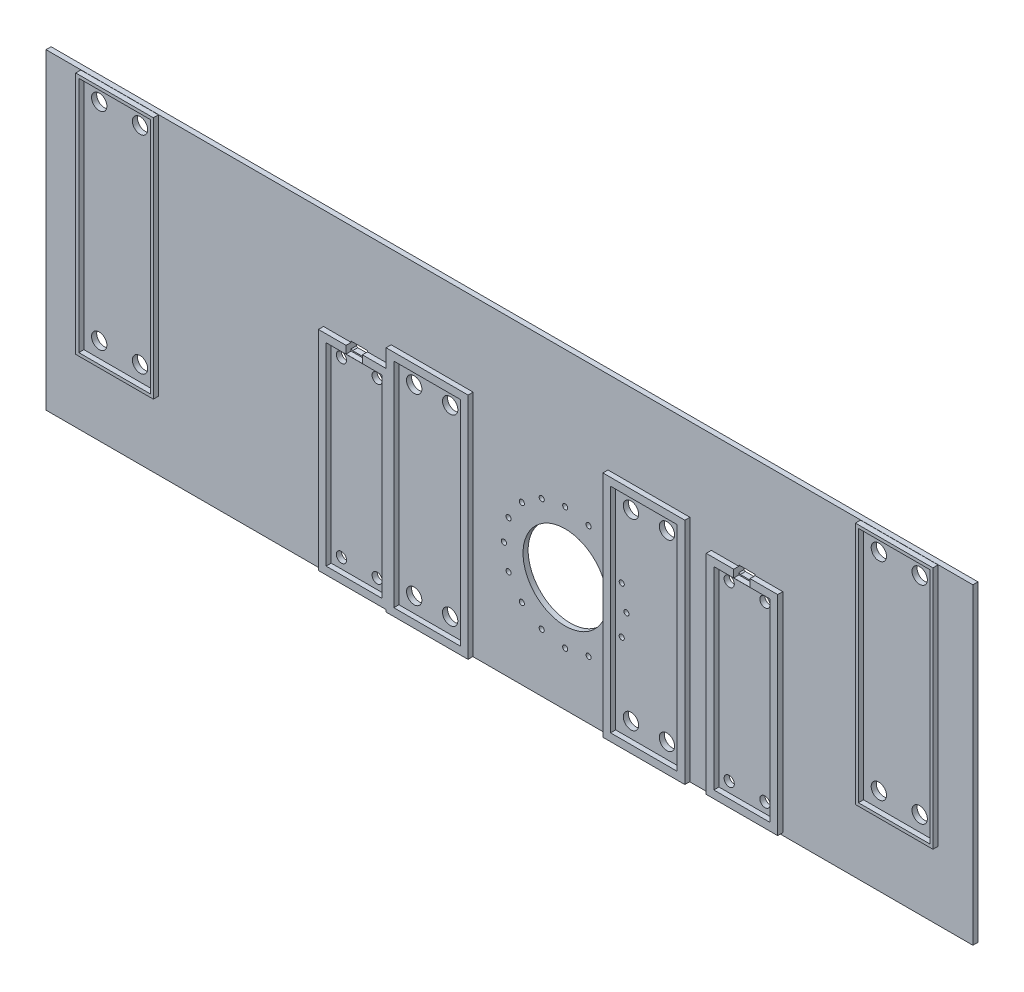
from build123d import *

# Parameters (mm, degrees)
SKETCH1_W               = 1816
SKETCH1_H               = 611.66
BOSS_EXTRUDE1_DEPTH     = 10
CUT_EXTRUDE1_DEPTH      = 959.173256202
SKETCH3_W               = 160.47075
SKETCH3_H               = 448.53406
SKETCH3_W_2             = 130.47075
SKETCH3_H_2             = 418.53406
BOSS_EXTRUDE2_DEPTH     = 10
CUT_EXTRUDE2_DEPTH      = 959.173256202
CUT_EXTRUDE2_DEPTH_BACK = 959.173256202
SKETCH4_R               = 15
SKETCH5_W               = 20
SKETCH5_H               = 35
SKETCH5_W_2             = 10
SKETCH5_H_2             = 25
BOSS_EXTRUDE3_DEPTH     = 5
SKETCH6_W               = 132.5833903
SKETCH6_H               = 409.0710211
SKETCH6_W_2             = 110
SKETCH6_H_2             = 379.0710211
SKETCH6_W_3             = 140
BOSS_EXTRUDE4_DEPTH     = 10
CUT_EXTRUDE3_DEPTH      = 959.329791304
BOSS_EXTRUDE5_DEPTH     = 10
BOSS_EXTRUDE6_DEPTH     = 10
SKETCH10_W              = 152
SKETCH10_H              = 477.4637013
SKETCH10_W_2            = 140
SKETCH10_H_2            = 465.4637013
BOSS_EXTRUDE7_DEPTH     = 10
SKETCH11_R              = 10
CUT_EXTRUDE4_DEPTH      = 959.238482268
SKETCH12_R              = 10
CUT_EXTRUDE5_DEPTH      = 959.238482268
SKETCH13_R              = 15
CUT_EXTRUDE6_DEPTH      = 959.238482268
SKETCH14_R              = 5
CUT_EXTRUDE7_DEPTH      = 10


with BuildPart() as part:
    # Sketch1 → Boss-Extrude1 (new body)
    with BuildSketch(Plane.XY):
        Rectangle(SKETCH1_W, SKETCH1_H)
    extrude(amount=BOSS_EXTRUDE1_DEPTH)

    # Sketch2 → Cut-Extrude1 (cut, through all)
    with BuildSketch(Plane.XY.offset(10)):
        with BuildLine():
            ThreePointArc((191.6519012, -81.04648), (142.832385163, -5.734628343), (54.1519012, -19.554610619))
            Line((54.1519012, -19.554610619), (54.1519012, -142.538349381))
            ThreePointArc((54.1519012, -142.538349381), (142.832385163, -156.358331657), (191.6519012, -81.04648))
        make_face()
        with BuildLine():
            Line((54.1519012, -142.538349381), (54.1519012, -19.554610619))
            ThreePointArc((54.1519012, -19.554610619), (26.6519012, -81.04648), (54.1519012, -142.538349381))
        make_face()
    extrude(amount=-CUT_EXTRUDE1_DEPTH, mode=Mode.SUBTRACT)

    # Sketch3 → Boss-Extrude2 (add)
    # profile 1 of 2: a face of its own
    with BuildSketch(Plane.XY.offset(10)):
        with Locations((-151.4012995, -81.04648)):
            Rectangle(SKETCH3_W, SKETCH3_H)
        with Locations((-151.4012995, -81.04648)):
            Rectangle(SKETCH3_W_2, SKETCH3_H_2, mode=Mode.SUBTRACT)
    # profile 2 of 2: a face of its own
    with BuildSketch(Plane.XY.offset(10)):
        with Locations((273.3256421, -81.04648)):
            Rectangle(SKETCH3_W, SKETCH3_H)
        with Locations((273.3256421, -81.04648)):
            Rectangle(SKETCH3_W_2, SKETCH3_H_2, mode=Mode.SUBTRACT)
    extrude(amount=BOSS_EXTRUDE2_DEPTH)

    # Sketch4 → Cut-Extrude2 (cut, two sides: drawn at the far end of the back side and taken through both)
    with BuildSketch(Plane.XY.offset(10).offset(-CUT_EXTRUDE2_DEPTH_BACK)):
        with Locations((-186.6366745, 98.2205489)):
            Circle(SKETCH4_R)
        with Locations((-116.1659245, 98.2205489)):
            Circle(SKETCH4_R)
        with Locations((-116.1659245, -260.3135111)):
            Circle(SKETCH4_R)
        with Locations((-186.6366745, -260.3135111)):
            Circle(SKETCH4_R)
        with Locations((238.0902671, 98.2205489)):
            Circle(SKETCH4_R)
        with Locations((308.5610171, 98.2205489)):
            Circle(SKETCH4_R)
        with Locations((308.5610171, -260.3135111)):
            Circle(SKETCH4_R)
        with Locations((238.0902671, -260.3135111)):
            Circle(SKETCH4_R)
    extrude(amount=CUT_EXTRUDE2_DEPTH + CUT_EXTRUDE2_DEPTH_BACK, mode=Mode.SUBTRACT)

    # Sketch5 → Boss-Extrude3 (add)
    # profile 1 of 4: a face of its own
    with BuildSketch(Plane(origin=(0, 0, 0), x_dir=(-1, 0, 0), z_dir=(0, 0, -1))):
        with Locations((-500.6519012, 122.970908)):
            Rectangle(SKETCH5_W, SKETCH5_H)
        with Locations((-500.6519012, 122.970908)):
            Rectangle(SKETCH5_W_2, SKETCH5_H_2, mode=Mode.SUBTRACT)
    # profile 2 of 4: a face of its own
    with BuildSketch(Plane(origin=(0, 0, 0), x_dir=(-1, 0, 0), z_dir=(0, 0, -1))):
        with Locations((-405.6519012, 122.970908)):
            Rectangle(SKETCH5_W, SKETCH5_H)
        with Locations((-405.6519012, 122.970908)):
            Rectangle(SKETCH5_W_2, SKETCH5_H_2, mode=Mode.SUBTRACT)
    # profile 3 of 4: a face of its own
    with BuildSketch(Plane(origin=(0, 0, 0), x_dir=(-1, 0, 0), z_dir=(0, 0, -1))):
        with Locations((-355.6519012, 122.970908)):
            Rectangle(SKETCH5_W, SKETCH5_H)
        with Locations((-355.6519012, 122.970908)):
            Rectangle(SKETCH5_W_2, SKETCH5_H_2, mode=Mode.SUBTRACT)
    # profile 4 of 4: a face of its own
    with BuildSketch(Plane(origin=(0, 0, 0), x_dir=(-1, 0, 0), z_dir=(0, 0, -1))):
        with Locations((234.4028544, 122.970908)):
            Rectangle(SKETCH5_W, SKETCH5_H)
        with Locations((234.4028544, 122.970908)):
            Rectangle(SKETCH5_W_2, SKETCH5_H_2, mode=Mode.SUBTRACT)
    extrude(amount=BOSS_EXTRUDE3_DEPTH)

    # Sketch6 → Boss-Extrude4 (add)
    # profile 1 of 2: a face of its own
    with BuildSketch(Plane.XY.offset(10)):
        with Locations((-297.92836965, -96.51096945)):
            Rectangle(SKETCH6_W, SKETCH6_H)
        with Locations((-294.2200648, -96.51096945)):
            Rectangle(SKETCH6_W_2, SKETCH6_H_2, mode=Mode.SUBTRACT)
    # profile 2 of 2: a face of its own
    with BuildSketch(Plane.XY.offset(10)):
        with Locations((465.5256093, -96.51096945)):
            Rectangle(SKETCH6_W_3, SKETCH6_H)
        with Locations((465.5256093, -96.51096945)):
            Rectangle(SKETCH6_W_2, SKETCH6_H_2, mode=Mode.SUBTRACT)
    extrude(amount=BOSS_EXTRUDE4_DEPTH)

    # Sketch7 → Cut-Extrude3 (cut, through all)
    with BuildSketch(Plane(origin=(0, 0, 0), x_dir=(-1, 0, 0), z_dir=(0, 0, -1))):
        Polygon((310.1378846, 98.2205489), (310.1378846, 93.2205489), (278.1378846, 93.2205489), (278.1378846, 98.2205489), (278.1378846, 110.2205489), (310.1378846, 110.2205489), align=None)
        Polygon((-481.4428912, 98.2205489), (-481.4428912, 110.2205489), (-449.4428912, 110.2205489), (-449.4428912, 98.2205489), (-449.4428912, 93.2205489), (-481.4428912, 93.2205489), align=None)
    extrude(amount=-CUT_EXTRUDE3_DEPTH, mode=Mode.SUBTRACT)

    # Sketch8 → Boss-Extrude5 (add)
    with BuildSketch(Plane(origin=(0, 0, 0), x_dir=(-1, 0, 0), z_dir=(0, 0, -1))):
        Polygon((281.0908096, 95.5245363), (307.1849596, 95.5245363), (310.1378846, 97.258141733), (310.1378846, 93.2205489), (278.1378846, 93.2205489), (278.1378846, 97.258141733), align=None)
    extrude(amount=-BOSS_EXTRUDE5_DEPTH)

    # Sketch9 → Boss-Extrude6 (add)
    with BuildSketch(Plane(origin=(0, 0, 0), x_dir=(-1, 0, 0), z_dir=(0, 0, -1))):
        Polygon((-478.4899662, 95.5245363), (-452.3958162, 95.5245363), (-449.4428912, 97.258141733), (-449.4428912, 93.2205489), (-481.4428912, 93.2205489), (-481.4428912, 97.258141733), align=None)
    extrude(amount=-BOSS_EXTRUDE6_DEPTH)

    # Sketch10 → Boss-Extrude7 (add)
    # profile 1 of 2: a face of its own
    with BuildSketch(Plane.XY.offset(10)):
        with Locations((763.7168147, 66.68536525)):
            Rectangle(SKETCH10_W, SKETCH10_H)
        with Locations((763.7168147, 66.68536525)):
            Rectangle(SKETCH10_W_2, SKETCH10_H_2, mode=Mode.SUBTRACT)
    # profile 2 of 2: a face of its own
    with BuildSketch(Plane.XY.offset(10)):
        with Locations((-763.7168147, 66.68536525)):
            Rectangle(SKETCH10_W, SKETCH10_H)
        with Locations((-763.7168147, 66.68536525)):
            Rectangle(SKETCH10_W_2, SKETCH10_H_2, mode=Mode.SUBTRACT)
    extrude(amount=BOSS_EXTRUDE7_DEPTH)

    # Sketch11 → Cut-Extrude4 (cut, through all)
    with BuildSketch(Plane.XY.offset(10)):
        with Locations((-329.2200648, 73.0245411)):
            Circle(SKETCH11_R)
        with Locations((-259.2200648, 73.0245411)):
            Circle(SKETCH11_R)
        with Locations((-259.2200648, -266.04648)):
            Circle(SKETCH11_R)
        with Locations((-329.2200648, -266.04648)):
            Circle(SKETCH11_R)
    extrude(amount=-CUT_EXTRUDE4_DEPTH, mode=Mode.SUBTRACT)

    # Sketch12 → Cut-Extrude5 (cut, through all)
    with BuildSketch(Plane.XY.offset(10)):
        with Locations((430.5256093, 73.0245411)):
            Circle(SKETCH12_R)
        with Locations((500.5256093, 73.0245411)):
            Circle(SKETCH12_R)
        with Locations((500.5256093, -266.04648)):
            Circle(SKETCH12_R)
        with Locations((430.5256093, -266.04648)):
            Circle(SKETCH12_R)
    extrude(amount=-CUT_EXTRUDE5_DEPTH, mode=Mode.SUBTRACT)

    # Sketch13 → Cut-Extrude6 (cut, through all)
    with BuildSketch(Plane.XY.offset(10)):
        with Locations((-723.7168147, -136.0464854)):
            Circle(SKETCH13_R)
        with Locations((-803.7168147, -136.0464854)):
            Circle(SKETCH13_R)
        with Locations((-723.7168147, 269.4172159)):
            Circle(SKETCH13_R)
        with Locations((-803.7168147, 269.4172159)):
            Circle(SKETCH13_R)
        with Locations((803.7168147, -136.0464854)):
            Circle(SKETCH13_R)
        with Locations((723.7168147, -136.0464854)):
            Circle(SKETCH13_R)
        with Locations((723.7168147, 269.4172159)):
            Circle(SKETCH13_R)
        with Locations((803.7168147, 269.4172159)):
            Circle(SKETCH13_R)
    extrude(amount=-CUT_EXTRUDE6_DEPTH, mode=Mode.SUBTRACT)

    # Sketch14 → Cut-Extrude7 (cut)
    with BuildSketch(Plane(origin=(0, 0, 0), x_dir=(-1, 0, 0), z_dir=(0, 0, -1))):
        with Locations((-109.1519012, 38.95352)):
            Circle(SKETCH14_R)
        with Locations((-63.229889316, 29.819063901)):
            Circle(SKETCH14_R)
        with Locations((-24.299087458, 3.806333742)):
            Circle(SKETCH14_R)
        with Locations((1.713642701, -35.124468116)):
            Circle(SKETCH14_R)
        with Locations((10.8480988, -81.04648)):
            Circle(SKETCH14_R)
        with Locations((1.713642701, -126.968491884)):
            Circle(SKETCH14_R)
        with Locations((-24.299087458, -165.899293742)):
            Circle(SKETCH14_R)
        with Locations((-63.229889316, -191.912023901)):
            Circle(SKETCH14_R)
        with Locations((-109.1519012, -201.04648)):
            Circle(SKETCH14_R)
        with Locations((-155.073913084, -191.912023901)):
            Circle(SKETCH14_R)
        with Locations((-194.004714942, -165.899293742)):
            Circle(SKETCH14_R)
        with Locations((-220.017445101, -126.968491884)):
            Circle(SKETCH14_R)
        with Locations((-229.1519012, -81.04648)):
            Circle(SKETCH14_R)
        with Locations((-220.017445101, -35.124468116)):
            Circle(SKETCH14_R)
        with Locations((-194.004714942, 3.806333742)):
            Circle(SKETCH14_R)
        with Locations((-155.073913084, 29.819063901)):
            Circle(SKETCH14_R)
    extrude(amount=-CUT_EXTRUDE7_DEPTH, mode=Mode.SUBTRACT)


solid = part.part
